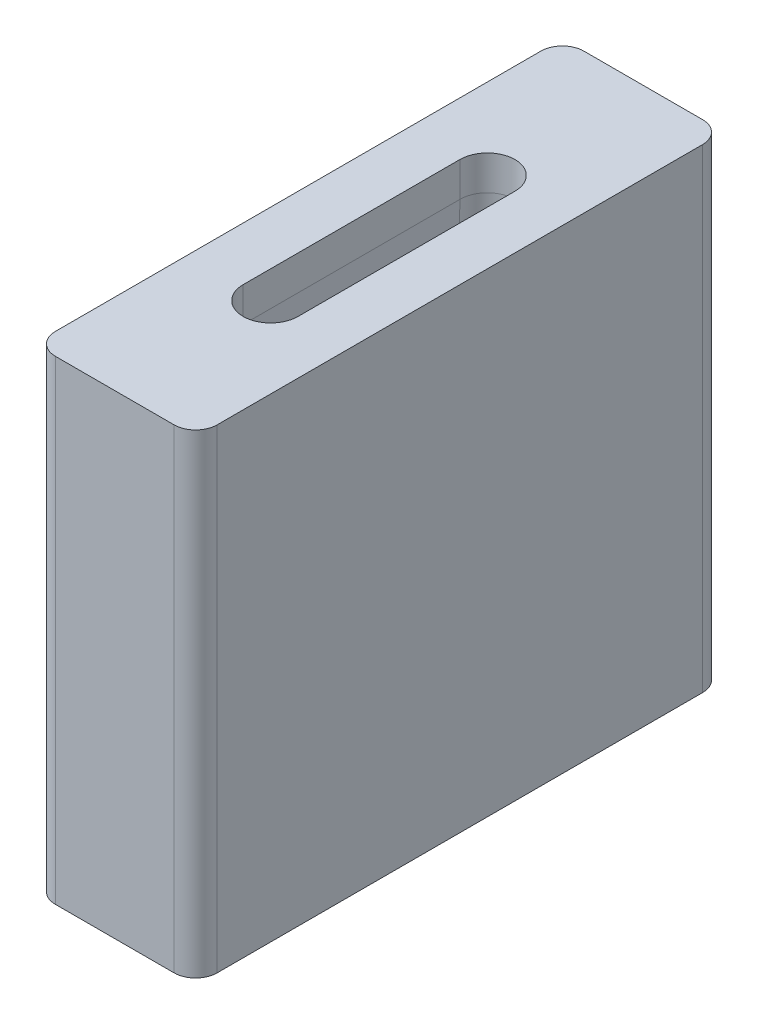
from build123d import *

# Parameters (mm, degrees)
BOSS_EXTRUDE1_DEPTH         = 44
CUT_EXTRUDE2_REACH          = 52.917
M6_TAPPED_HOLE1_D           = 5
M6_TAPPED_HOLE1_DEPTH       = 17
M6_TAPPED_HOLE1_CSINK_D     = 6.05
M6_TAPPED_HOLE1_CSINK_ANGLE = 90
M6_TAPPED_HOLE1_TIP         = 1.502151548


with BuildPart() as part:
    # Sketch1 → Boss-Extrude1 (new body)
    with BuildSketch(Plane(origin=(0, 0, 0), x_dir=(1, 0, 0), z_dir=(0, 1, 0))):
        with BuildLine():
            Line((-5.5, -24.5), (5.5, -24.5))
            ThreePointArc((5.5, -24.5), (6.914213562, -23.914213562), (7.5, -22.5))
            Line((7.5, -22.5), (7.5, 22.5))
            ThreePointArc((7.5, 22.5), (6.914213562, 23.914213562), (5.5, 24.5))
            Line((5.5, 24.5), (-5.5, 24.5))
            ThreePointArc((-5.5, 24.5), (-6.914213562, 23.914213562), (-7.5, 22.5))
            Line((-7.5, 22.5), (-7.5, -22.5))
            ThreePointArc((-7.5, -22.5), (-6.914213562, -23.914213562), (-5.5, -24.5))
        make_face()
    extrude(amount=-BOSS_EXTRUDE1_DEPTH)

    # Sketch5 → Cut-Extrude2 (cut, up to next)
    with BuildSketch(Plane(origin=(0, 0, 0), x_dir=(1, 0, 0), z_dir=(0, 1, 0)), mode=Mode.PRIVATE) as cut_extrude2_sk1:
        with BuildLine():
            Line((-2.55, -10.05), (-2.55, 10.05))
            ThreePointArc((-2.55, 10.05), (0, 12.6), (2.55, 10.05))
            Line((2.55, 10.05), (2.55, -10.05))
            ThreePointArc((2.55, -10.05), (0, -12.6), (-2.55, -10.05))
        make_face()
    cut_extrude2_tool1 = extrude(cut_extrude2_sk1.sketch, amount=-CUT_EXTRUDE2_REACH, mode=Mode.PRIVATE) & part.part
    add(cut_extrude2_tool1.solids().sort_by_distance((0, 0, 0))[0], mode=Mode.SUBTRACT)

    # Cut-Sweep1: sweep along a path in Sketch8
    with BuildLine(Plane(origin=(0, 0, 0), x_dir=(1, 0, 0), z_dir=(0, 1, 0))) as cut_sweep1_path:
        Line((-2.55, 10.05), (-2.55, -10.05))
        ThreePointArc((-2.55, -10.05), (0, -12.6), (2.55, -10.05))
        Line((2.55, -10.05), (2.55, 10.05))
        ThreePointArc((2.55, 10.05), (0, 12.6), (-2.55, 10.05))
    # Sketch7 → Cut-Sweep1 (sweep, cut)
    with BuildSketch(Plane.XY):
        Polygon((2.55, -3.2), (3.262166649, -44), (2.55, -44), align=None)
    sweep(path=cut_sweep1_path.line, mode=Mode.SUBTRACT)

    # M6 Tapped Hole1
    with Locations(Plane(origin=(0, -44, 0), x_dir=(-1, 0, 0), z_dir=(0, -1, 0))):
        with Locations((0, 20.5), (0, -20.5)):
            CounterSinkHole(M6_TAPPED_HOLE1_D / 2, M6_TAPPED_HOLE1_CSINK_D / 2, depth=M6_TAPPED_HOLE1_DEPTH, counter_sink_angle=M6_TAPPED_HOLE1_CSINK_ANGLE)
            with Locations((0, 0, -(M6_TAPPED_HOLE1_DEPTH + M6_TAPPED_HOLE1_TIP / 2))):  # 118° drill point
                Cone(0, M6_TAPPED_HOLE1_D / 2, M6_TAPPED_HOLE1_TIP, mode=Mode.SUBTRACT)


solid = part.part
